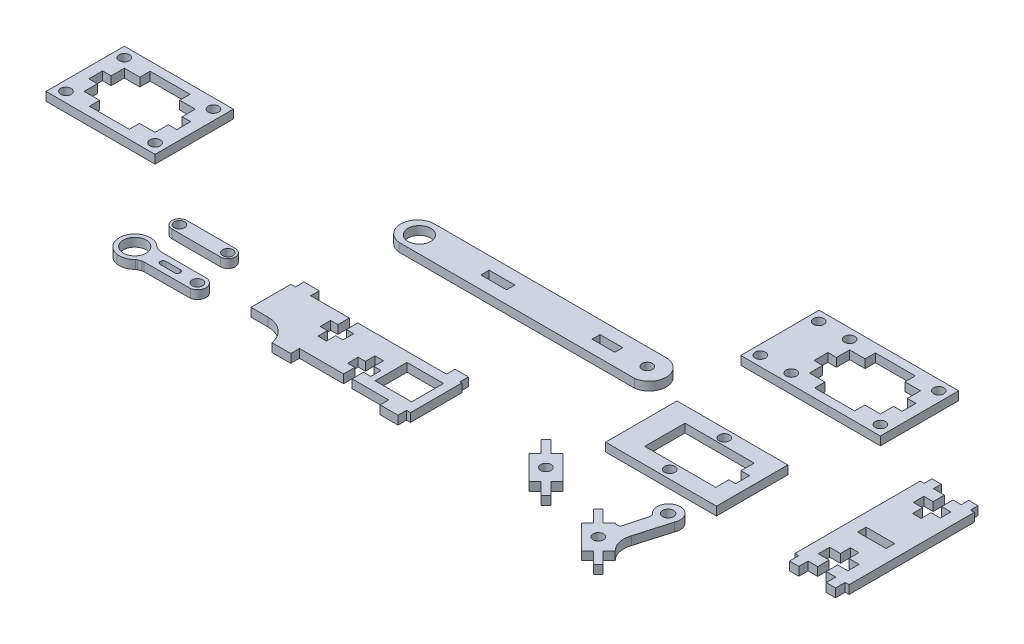
from build123d import *

# Parameters (mm, degrees)
SKETCH6_W            = 10
SKETCH6_H            = 3
BOSS_EXTRUDE1_DEPTH  = 3
SKETCH12_R           = 4
SKETCH12_R_2         = 1.82
SKETCH12_W           = 8
SKETCH12_H           = 2.8
SKETCH12_W_2         = 9
SKETCH12_H_2         = 2.9
BOSS_EXTRUDE3_DEPTH  = 3
SKETCH37_R           = 1.925
SKETCH37_R_2         = 1.820084062
BOSS_EXTRUDE7_DEPTH  = 3
SKETCH36_R           = 1.82
BOSS_EXTRUDE8_DEPTH  = 3
SKETCH32_R           = 4
SKETCH32_R_2         = 1.82
BOSS_EXTRUDE12_DEPTH = 3
SKETCH31_R           = 1.82
BOSS_EXTRUDE13_DEPTH = 3
SKETCH30_W           = 12.829032702
SKETCH30_H           = 11.189767412
BOSS_EXTRUDE14_DEPTH = 3
SKETCH29_W           = 48.986568283
SKETCH29_H           = 27.49
SKETCH29_R           = 1.82
BOSS_EXTRUDE15_DEPTH = 3
SKETCH28_W           = 38.915686477
SKETCH28_H           = 25.075379572
SKETCH28_R           = 1.82
BOSS_EXTRUDE16_DEPTH = 3
SKETCH27_W           = 38.28
SKETCH27_H           = 27.49
SKETCH27_R           = 1.82
BOSS_EXTRUDE17_DEPTH = 3


with BuildPart() as part:
    # Sketch6 → Boss-Extrude1 (new body)
    with BuildSketch(Plane(origin=(0, 0, -6.873626876), x_dir=(1, 0, 0), z_dir=(0, 1, 0))):
        Polygon((172.399287959, 17.523976804), (172.399287959, 14.779888825), (176.279351087, 14.779888825), (176.279351087, 10.779888825), (173.032045346, 10.779888825), (173.032045346, 7.062992514), (176.279351087, 7.062992514), (176.279351087, 3.562992514), (179.279351087, 3.562992514), (179.279351087, 7.062992514), (182.543927994, 7.062992514), (182.543927994, 10.779888825), (179.279351087, 10.779888825), (179.279351087, 14.779888825), (182.127695455, 14.779888825), (182.127695455, 17.421571169), (185.39570021, 17.421571169), (185.39570021, 14.779888825), (186.763491707, 14.779888825), (186.763491707, -29.220111175), (185.39570021, -29.220111175), (185.39570021, -32.578428831), (182.127695455, -32.578428831), (182.127695455, -29.220111175), (178.763491707, -29.220111175), (178.763491707, -25.220111175), (182.34039673, -25.220111175), (182.34039673, -21.252563381), (178.763491707, -21.252563381), (178.763491707, -17.752563381), (175.763491707, -17.752563381), (175.763491707, -21.252563381), (171.982778318, -21.252563381), (171.982778318, -25.220111175), (175.763491707, -25.220111175), (175.763491707, -29.220111175), (172.399287959, -29.220111175), (172.399287959, -32.476023196), (169.131283204, -32.476023196), (169.131283204, -29.220111175), (167.763491707, -29.220111175), (167.763491707, 14.779888825), (169.131283204, 14.779888825), (169.131283204, 17.523976804), align=None)
        with Locations((177.263491707, -10.220111175)):
            Rectangle(SKETCH6_W, SKETCH6_H, mode=Mode.SUBTRACT)
    extrude(amount=BOSS_EXTRUDE1_DEPTH)


with BuildPart() as body_2:
    # Sketch12 → Boss-Extrude3 (new body)
    with BuildSketch(Plane(origin=(0, 0, 0), x_dir=(1, 0, 0), z_dir=(0, 1, 0))):
        with BuildLine():
            Line((4.341326737, 14.556735234), (85.684903737, 14.556735234))
            ThreePointArc((85.684903737, 14.556735234), (91.600129517, 8.964381612), (86.348243737, 2.744895234))
            Line((86.348243737, 2.744895234), (3.677987737, 2.744895234))
            ThreePointArc((3.677987737, 2.744895234), (-1.573899016, 8.964381166), (4.341326737, 14.556735234))
        make_face()
        with Locations(Location((5.013113737, 8.594465234, 0), (0, 0, 270))):
            Circle(SKETCH12_R, mode=Mode.SUBTRACT)
        with Locations(Location((85.013113737, 8.594465234, 0), (0, 0, 270))):
            Circle(SKETCH12_R_2, mode=Mode.SUBTRACT)
        with Locations((71.013113737, 8.594465234)):
            Rectangle(SKETCH12_W, SKETCH12_H, mode=Mode.SUBTRACT)
        with Locations((32.513113737, 8.644465234)):
            Rectangle(SKETCH12_W_2, SKETCH12_H_2, mode=Mode.SUBTRACT)
    extrude(amount=BOSS_EXTRUDE3_DEPTH)


with BuildPart() as body_3:
    # Sketch37 → Boss-Extrude7 (new body)
    with BuildSketch(Plane(origin=(0, 0, 0), x_dir=(1, 0, 0), z_dir=(0, 1, 0))):
        with BuildLine():
            Line((135.416931039, -53.065113132), (133.295631039, -55.186433132))
            Line((133.295631039, -55.186433132), (137.538231039, -59.429073132))
            Line((137.538231039, -59.429073132), (135.841231039, -61.126133132))
            Line((135.841231039, -61.126133132), (131.598536039, -56.883478133))
            Line((131.598536039, -56.883478133), (129.477231039, -59.004803132))
            Line((129.477231039, -59.004803132), (120.991931039, -50.519523132))
            Line((120.991931039, -50.519523132), (123.113231039, -48.398203132))
            Line((123.113231039, -48.398203132), (118.870631039, -44.155563132))
            Line((118.870631039, -44.155563132), (120.567731039, -42.458513132))
            Line((120.567731039, -42.458513132), (124.810331039, -46.701153132))
            Line((124.810331039, -46.701153132), (126.931631039, -44.579833132))
            ThreePointArc((126.931631039, -44.579833132), (128.3731971, -44.866573152), (129.189776664, -43.644472353))
            Line((129.189776664, -43.644472353), (131.031331039, -36.797713132))
            Line((131.031331039, -36.797713132), (131.031331039, -35.560926023))
            ThreePointArc((131.031331039, -35.560926023), (132.351622678, -28.380853468), (137.105137206, -33.921675748))
            Line((137.105137206, -33.921675748), (133.719881039, -45.640493132))
            ThreePointArc((133.719881039, -45.640493132), (133.499523475, -49.597118283), (135.416931039, -53.065113132))
        make_face()
        with Locations(Location((133.380831039, -32.473803132, 0), (0, 0, 270))):
            Circle(SKETCH37_R, mode=Mode.SUBTRACT)
        with Locations(Location((128.204431039, -51.792318132, 0), (0, 0, 270))):
            Circle(SKETCH37_R_2, mode=Mode.SUBTRACT)
    extrude(amount=BOSS_EXTRUDE7_DEPTH)


with BuildPart() as body_4:
    # Sketch36 → Boss-Extrude8 (new body)
    with BuildSketch(Plane(origin=(0, 0, 0), x_dir=(1, 0, 0), z_dir=(0, 1, 0))):
        Polygon((96.673482596, -32.709345316), (105.158807596, -41.194610317), (103.037507596, -43.315930317), (107.280107596, -47.558570317), (105.583007596, -49.255630317), (101.340407596, -45.012990317), (99.219107596, -47.134310317), (90.733787596, -38.649050316), (92.855087596, -36.527730316), (88.612487596, -32.285080316), (90.309487596, -30.588030316), (94.552187596, -34.830670316), align=None)
        with Locations(Location((97.946287596, -39.921835316, 0), (0, 0, 270))):
            Circle(SKETCH36_R, mode=Mode.SUBTRACT)
    extrude(amount=BOSS_EXTRUDE8_DEPTH)


with BuildPart() as body_5:
    # Sketch32 → Boss-Extrude12 (new body)
    with BuildSketch(Plane(origin=(0, 0, 0), x_dir=(1, 0, 0), z_dir=(0, 1, 0))):
        with BuildLine():
            Line((-19.36914183, -41.927583736), (-34.56840183, -41.927583736))
            ThreePointArc((-34.56840183, -41.927583736), (-36.610920732, -41.514897293), (-38.33299183, -40.341583736))
            ThreePointArc((-38.33299183, -40.341583736), (-46.44581726, -43.02098744), (-42.10250183, -50.378483736))
            ThreePointArc((-42.10250183, -50.378483736), (-39.526546927, -50.143964494), (-37.33824183, -48.764883736))
            ThreePointArc((-37.33824183, -48.764883736), (-37.104936069, -48.582602103), (-36.83149183, -48.469083736))
            ThreePointArc((-36.83149183, -48.469083736), (-36.272218299, -48.292742498), (-35.73188183, -48.064883736))
            Line((-35.73188183, -48.064883736), (-35.15418183, -47.961983736))
            Line((-35.15418183, -47.961983736), (-18.89983183, -47.890683736))
            ThreePointArc((-18.89983183, -47.890683736), (-16.378372134, -44.692221025), (-19.36914183, -41.927583736))
        make_face()
        with Locations(Location((-41.36914183, -44.927583736, 0), (0, 0, 270))):
            Circle(SKETCH32_R, mode=Mode.SUBTRACT)
        with Locations(Location((-19.36914183, -44.927583736, 0), (0, 0, 270))):
            Circle(SKETCH32_R_2, mode=Mode.SUBTRACT)
        with BuildLine():
            Line((-31.444062815, -43.954380187), (-26.384920775, -43.954380187))
            ThreePointArc((-26.384920775, -43.954380187), (-25.411699325, -44.927601637), (-26.384920775, -45.900823087))
            Line((-26.384920775, -45.900823087), (-31.444062815, -45.900823087))
            ThreePointArc((-31.444062815, -45.900823087), (-32.417284265, -44.927601637), (-31.444062815, -43.954380187))
        make_face(mode=Mode.SUBTRACT)
    extrude(amount=BOSS_EXTRUDE12_DEPTH)


with BuildPart() as body_6:
    # Sketch31 → Boss-Extrude13 (new body)
    with BuildSketch(Plane(origin=(0, 0, 0), x_dir=(1, 0, 0), z_dir=(0, 1, 0))):
        with BuildLine():
            Line((-40.179943501, -27.841063029), (-23.179943501, -27.841063029))
            ThreePointArc((-23.179943501, -27.841063029), (-20.579943501, -30.441063029), (-23.179943501, -33.041063029))
            Line((-23.179943501, -33.041063029), (-40.179943501, -33.041063029))
            ThreePointArc((-40.179943501, -33.041063029), (-42.779943501, -30.441063029), (-40.179943501, -27.841063029))
        make_face()
        with Locations(Location((-40.179943501, -30.441063029, 0), (0, 0, 270))):
            Circle(SKETCH31_R, mode=Mode.SUBTRACT)
        with Locations(Location((-23.179943501, -30.441063029, 0), (0, 0, 270))):
            Circle(SKETCH31_R, mode=Mode.SUBTRACT)
    extrude(amount=BOSS_EXTRUDE13_DEPTH)


with BuildPart() as body_7:
    # Sketch30 → Boss-Extrude14 (new body)
    with BuildSketch(Plane(origin=(0, 0, 0), x_dir=(1, 0, 0), z_dir=(0, 1, 0))):
        with BuildLine():
            Line((17.989001206, -28.987247688), (4.444811469, -28.987247688))
            Line((4.444811469, -28.987247688), (4.444811469, -25.987247688))
            Line((4.444811469, -25.987247688), (-0.897656492, -25.987247688))
            Line((-0.897656492, -25.987247688), (-0.897656492, -28.987247688))
            Line((-0.897656492, -28.987247688), (-2.510998794, -28.987247688))
            Line((-2.510998794, -28.987247688), (-2.510998794, -42.987247688))
            Line((-2.510998794, -42.987247688), (3.489001206, -42.987247688))
            ThreePointArc((3.489001206, -42.987247688), (8.99164502, -44.988487761), (11.923078261, -50.057092098))
            Line((11.923078261, -50.057092098), (18.516467718, -50.057092098))
            Line((18.516467718, -50.057092098), (18.516467718, -46.987247688))
            Line((18.516467718, -46.987247688), (33.989001206, -46.987247688))
            Line((33.989001206, -46.987247688), (33.989001206, -42.987247688))
            Line((33.989001206, -42.987247688), (31.439187703, -42.987247688))
            Line((31.439187703, -42.987247688), (31.439187703, -39.342217355))
            Line((31.439187703, -39.342217355), (33.989001206, -39.342217355))
            Line((33.989001206, -39.342217355), (33.989001206, -35.987247688))
            Line((33.989001206, -35.987247688), (36.989001206, -35.987247688))
            Line((36.989001206, -35.987247688), (36.989001206, -39.377416544))
            Line((36.989001206, -39.377416544), (39.538814709, -39.377416544))
            Line((39.538814709, -39.377416544), (39.538814709, -42.987247688))
            Line((39.538814709, -42.987247688), (36.989001206, -42.987247688))
            Line((36.989001206, -42.987247688), (36.989001206, -46.987247688))
            Line((36.989001206, -46.987247688), (49.806704855, -46.987247688))
            Line((49.806704855, -46.987247688), (49.806704855, -49.987247688))
            Line((49.806704855, -49.987247688), (56.089831613, -49.987247688))
            Line((56.089831613, -49.987247688), (56.089831613, -46.987247688))
            Line((56.089831613, -46.987247688), (57.489001206, -46.987247688))
            Line((57.489001206, -46.987247688), (57.489001206, -28.987247688))
            Line((57.489001206, -28.987247688), (56.796170046, -28.987247688))
            Line((56.796170046, -28.987247688), (56.796170046, -25.987247688))
            Line((56.796170046, -25.987247688), (52.112653441, -25.987247688))
            Line((52.112653441, -25.987247688), (52.112653441, -28.987247688))
            Line((52.112653441, -28.987247688), (20.989001206, -28.987247688))
            Line((20.989001206, -28.987247688), (20.989001206, -32.987247688))
            Line((20.989001206, -32.987247688), (23.539001206, -32.987247688))
            Line((23.539001206, -32.987247688), (23.539001206, -36.750545316))
            Line((23.539001206, -36.750545316), (20.989001206, -36.750545316))
            Line((20.989001206, -36.750545316), (20.989001206, -39.987247688))
            Line((20.989001206, -39.987247688), (17.989001206, -39.987247688))
            Line((17.989001206, -39.987247688), (17.989001206, -36.692137372))
            Line((17.989001206, -36.692137372), (15.439001206, -36.692137372))
            Line((15.439001206, -36.692137372), (15.439001206, -32.987247688))
            Line((15.439001206, -32.987247688), (17.989001206, -32.987247688))
            Line((17.989001206, -32.987247688), (17.989001206, -28.987247688))
        make_face()
        with Locations((48.015629764, -37.939010766)):
            Rectangle(SKETCH30_W, SKETCH30_H, mode=Mode.SUBTRACT)
    extrude(amount=BOSS_EXTRUDE14_DEPTH)


with BuildPart() as body_8:
    # Sketch29 → Boss-Extrude15 (new body)
    with BuildSketch(Plane(origin=(0, 0, 0), x_dir=(1, 0, 0), z_dir=(0, 1, 0))):
        with Locations((122.572283276, 42.09553163)):
            Rectangle(SKETCH29_W, SKETCH29_H)
        with Locations(Location((112.285567417, 52.34053163, 0), (0, 0, 270))):
            Circle(SKETCH29_R, mode=Mode.SUBTRACT)
        with Locations(Location((112.285567417, 31.85053163, 0), (0, 0, 270))):
            Circle(SKETCH29_R, mode=Mode.SUBTRACT)
        with Locations(Location((143.565567417, 31.852610894, 0), (0, 0, 270))):
            Circle(SKETCH29_R, mode=Mode.SUBTRACT)
        with Locations(Location((143.565567417, 52.34053163, 0), (0, 0, 270))):
            Circle(SKETCH29_R, mode=Mode.SUBTRACT)
        with Locations(Location((101.419723314, 52.34053163, 0), (0, 0, 270))):
            Circle(SKETCH29_R, mode=Mode.SUBTRACT)
        with Locations(Location((101.419723314, 31.85053163, 0), (0, 0, 270))):
            Circle(SKETCH29_R, mode=Mode.SUBTRACT)
        Polygon((120.925567417, 52.752610894), (134.925567417, 52.752610894), (134.925567417, 49.152610894), (140.375567417, 49.152610894), (140.375567417, 44.522610894), (143.375567417, 44.522610894), (143.375567417, 39.672610894), (140.375567417, 39.672610894), (140.375567417, 35.042610894), (134.925567417, 35.042610894), (134.925567417, 31.442610894), (120.925567417, 31.442610894), (120.925567417, 35.04053163), (115.475567417, 35.04053163), (115.475567417, 39.67053163), (112.475567417, 39.67053163), (112.475567417, 44.52053163), (115.475567417, 44.52053163), (115.475567417, 49.15053163), (120.925567417, 49.15053163), align=None, mode=Mode.SUBTRACT)
    extrude(amount=BOSS_EXTRUDE15_DEPTH)


with BuildPart() as body_9:
    # Sketch28 → Boss-Extrude16 (new body)
    with BuildSketch(Plane(origin=(0, 0, 0), x_dir=(1, 0, 0), z_dir=(0, 1, 0))):
        with Locations((120.170265531, -9.205589699)):
            Rectangle(SKETCH28_W, SKETCH28_H)
        with Locations(Location((120.239615059, 0.383983872, 0), (0, 0, 270))):
            Circle(SKETCH28_R, mode=Mode.SUBTRACT)
        with Locations(Location((120.239615059, -18.756016128, 0), (0, 0, 270))):
            Circle(SKETCH28_R, mode=Mode.SUBTRACT)
        Polygon((108.859685419, -2.043178807), (133.149685419, -2.043178807), (133.149685419, -6.673178807), (136.149685419, -6.673178807), (136.149685419, -11.523178807), (133.794905272, -11.523178807), (133.794905272, -16.153178807), (108.859685419, -16.153178807), align=None, mode=Mode.SUBTRACT)
    extrude(amount=BOSS_EXTRUDE16_DEPTH)


with BuildPart() as body_10:
    # Sketch27 → Boss-Extrude17 (new body)
    with BuildSketch(Plane(origin=(0, 0, 0), x_dir=(1, 0, 0), z_dir=(0, 1, 0))):
        with Locations((-84.983138589, 0.416584013)):
            Rectangle(SKETCH27_W, SKETCH27_H)
        with Locations(Location((-100.623138589, 10.661584013, 0), (0, 0, 270))):
            Circle(SKETCH27_R, mode=Mode.SUBTRACT)
        with Locations(Location((-100.623138589, -9.828415987, 0), (0, 0, 270))):
            Circle(SKETCH27_R, mode=Mode.SUBTRACT)
        with Locations(Location((-69.343138589, -9.826336724, 0), (0, 0, 270))):
            Circle(SKETCH27_R, mode=Mode.SUBTRACT)
        with Locations(Location((-69.343138589, 10.661584013, 0), (0, 0, 270))):
            Circle(SKETCH27_R, mode=Mode.SUBTRACT)
        Polygon((-91.983138589, 11.073663276), (-77.983138589, 11.073663276), (-77.983138589, 7.473663276), (-72.533138589, 7.473663276), (-72.533138589, 2.843663276), (-69.533138589, 2.843663276), (-69.533138589, -2.006336724), (-72.533138589, -2.006336724), (-72.533138589, -6.636336724), (-77.983138589, -6.636336724), (-77.983138589, -10.236336724), (-91.983138589, -10.236336724), (-91.983138589, -6.638415987), (-97.433138589, -6.638415987), (-97.433138589, -2.008415987), (-100.433138589, -2.008415987), (-100.433138589, 2.841584013), (-97.433138589, 2.841584013), (-97.433138589, 7.471584013), (-91.983138589, 7.471584013), align=None, mode=Mode.SUBTRACT)
    extrude(amount=BOSS_EXTRUDE17_DEPTH)


solid = Compound([part.part, body_2.part, body_3.part, body_4.part, body_5.part, body_6.part, body_7.part, body_8.part, body_9.part, body_10.part])
